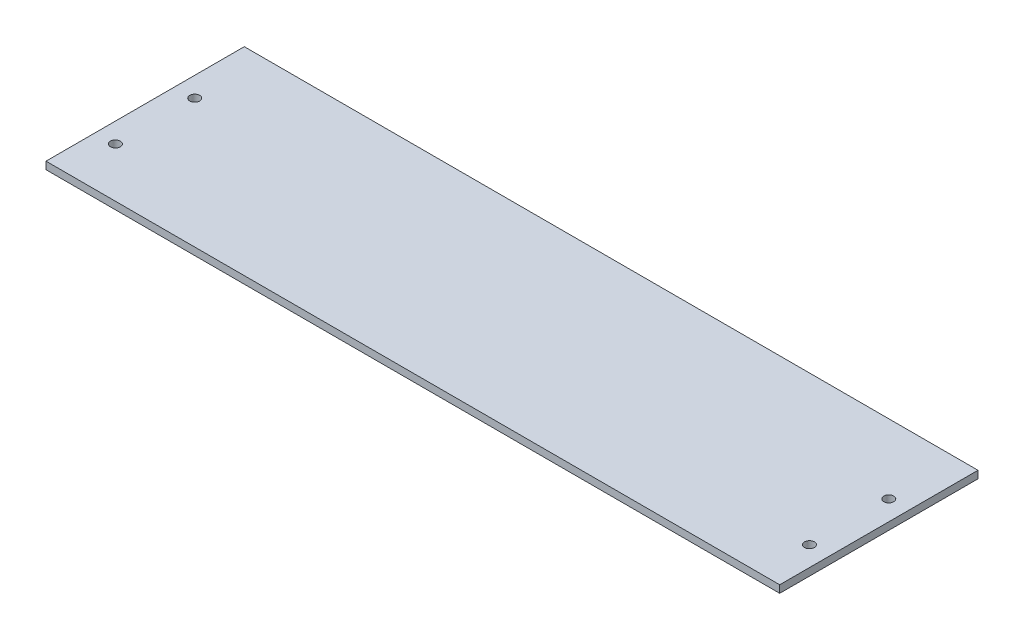
from build123d import *

# Parameters (mm, degrees)
SKETCH1_W           = 296
SKETCH1_H           = 80
SKETCH1_R           = 2
BOSS_EXTRUDE1_DEPTH = 3


with BuildPart() as part:
    # Sketch1 → Boss-Extrude1 (new body)
    with BuildSketch(Plane(origin=(0, 0, 0), x_dir=(1, 0, 0), z_dir=(0, 1, 0))):
        with Locations((-148, 40)):
            Rectangle(SKETCH1_W, SKETCH1_H)
        with Locations(Location((-8, 20, 0), (0, 0, 270))):
            Circle(SKETCH1_R, mode=Mode.SUBTRACT)
        with Locations(Location((-8, 52, 0), (0, 0, 270))):
            Circle(SKETCH1_R, mode=Mode.SUBTRACT)
        with Locations(Location((-288, 52, 0), (0, 0, 90))):
            Circle(SKETCH1_R, mode=Mode.SUBTRACT)
        with Locations(Location((-288, 20, 0), (0, 0, 90))):
            Circle(SKETCH1_R, mode=Mode.SUBTRACT)
    extrude(amount=BOSS_EXTRUDE1_DEPTH)


solid = part.part
